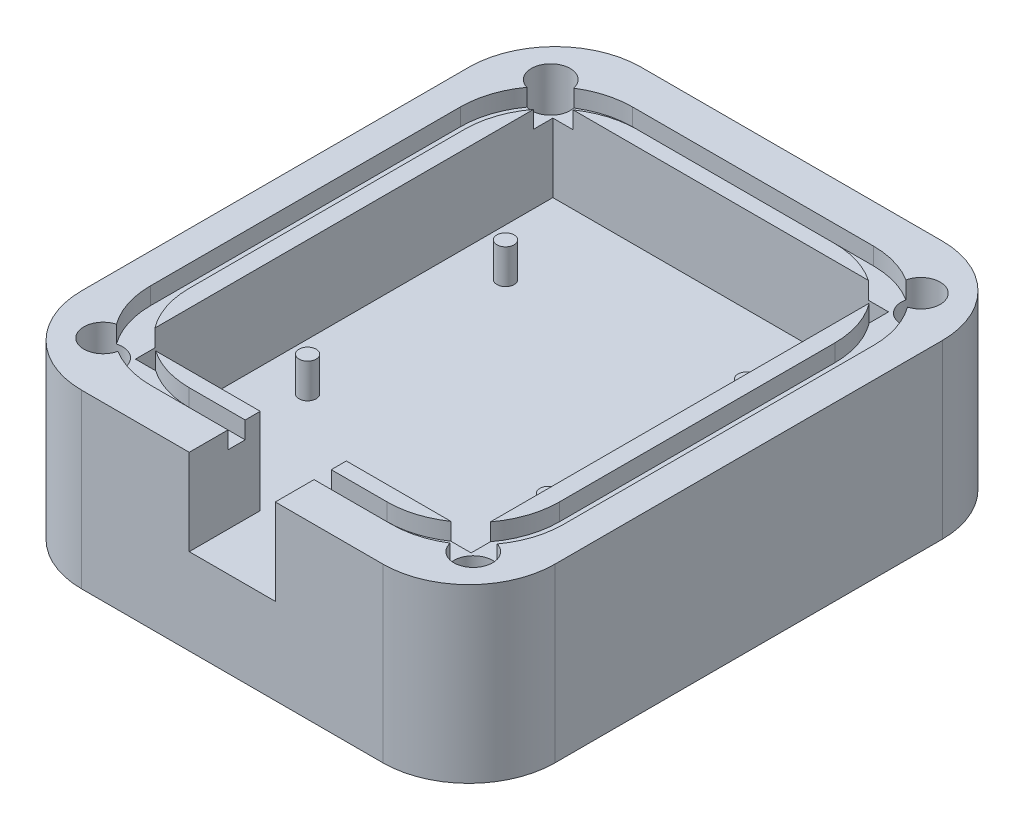
from build123d import *

# Parameters (mm, degrees)
BOSS_EXTRUDE1_DEPTH = 10
SKETCH2_W           = 39
SKETCH2_H           = 48.5
BOSS_EXTRUDE2_DEPTH = 10
SKETCH6_R           = 1
BOSS_EXTRUDE3_DEPTH = 4
SKETCH7_W           = 10
SKETCH7_H           = 8.25
CUT_EXTRUDE1_DEPTH  = 10
SKETCH8_R           = 2.25
CUT_EXTRUDE2_DEPTH  = 15
CUT_EXTRUDE3_DEPTH  = 2


with BuildPart() as part:
    # Sketch1 → Boss-Extrude1 (new body)
    with BuildSketch(Plane(origin=(0, 0, 0), x_dir=(1, 0, 0), z_dir=(0, 1, 0))):
        with BuildLine():
            Line((-17.5, 32.5), (17.5, 32.5))
            ThreePointArc((17.5, 32.5), (24.571067812, 29.571067812), (27.5, 22.5))
            Line((27.5, 22.5), (27.5, -22.5))
            ThreePointArc((27.5, -22.5), (24.571067812, -29.571067812), (17.5, -32.5))
            Line((17.5, -32.5), (-17.5, -32.5))
            ThreePointArc((-17.5, -32.5), (-24.571067812, -29.571067812), (-27.5, -22.5))
            Line((-27.5, -22.5), (-27.5, 22.5))
            ThreePointArc((-27.5, 22.5), (-24.571067812, 29.571067812), (-17.5, 32.5))
        make_face()
    extrude(amount=BOSS_EXTRUDE1_DEPTH)

    # Sketch2 → Boss-Extrude2 (add)
    with BuildSketch(Plane(origin=(0, 10, 0), x_dir=(1, 0, 0), z_dir=(0, 1, 0))):
        with BuildLine():
            Line((27.5, 22.5), (27.5, -22.5))
            ThreePointArc((27.5, -22.5), (24.571067812, -29.571067812), (17.5, -32.5))
            Line((17.5, -32.5), (-17.5, -32.5))
            ThreePointArc((-17.5, -32.5), (-24.571067812, -29.571067812), (-27.5, -22.5))
            Line((-27.5, -22.5), (-27.5, 22.5))
            ThreePointArc((-27.5, 22.5), (-24.571067812, 29.571067812), (-17.5, 32.5))
            Line((-17.5, 32.5), (17.5, 32.5))
            ThreePointArc((17.5, 32.5), (24.571067812, 29.571067812), (27.5, 22.5))
        make_face()
        Rectangle(SKETCH2_W, SKETCH2_H, mode=Mode.SUBTRACT)
    extrude(amount=BOSS_EXTRUDE2_DEPTH)

    # Sketch6 → Boss-Extrude3 (add)
    with BuildSketch(Plane(origin=(0, 10, 0), x_dir=(1, 0, 0), z_dir=(0, 1, 0))):
        with Locations(Location((-14, 13.25, 0), (0, 0, 90))):
            Circle(SKETCH6_R)
        with Locations(Location((14, 13.25, 0), (0, 0, 90))):
            Circle(SKETCH6_R)
        with Locations(Location((14, -9.75, 0), (0, 0, 90))):
            Circle(SKETCH6_R)
        with Locations(Location((-14, -9.75, 0), (0, 0, 90))):
            Circle(SKETCH6_R)
    extrude(amount=BOSS_EXTRUDE3_DEPTH)

    # Sketch7 → Cut-Extrude1 (cut)
    with BuildSketch(Plane(origin=(0, 20, 0), x_dir=(1, 0, 0), z_dir=(0, 1, 0))):
        with Locations((0, -28.375)):
            Rectangle(SKETCH7_W, SKETCH7_H)
    extrude(amount=-CUT_EXTRUDE1_DEPTH, mode=Mode.SUBTRACT)

    # Sketch8 → Cut-Extrude2 (cut)
    with BuildSketch(Plane(origin=(0, 20, 0), x_dir=(1, 0, 0), z_dir=(0, 1, 0))):
        with Locations(Location((-21.5, -26, 0), (0, 0, 270))):
            Circle(SKETCH8_R)
        with Locations(Location((21.5, -26, 0), (0, 0, 270))):
            Circle(SKETCH8_R)
        with Locations(Location((21.5, 26, 0), (0, 0, 270))):
            Circle(SKETCH8_R)
        with Locations(Location((-21.5, 26, 0), (0, 0, 270))):
            Circle(SKETCH8_R)
    extrude(amount=-CUT_EXTRUDE2_DEPTH, mode=Mode.SUBTRACT)

    # Sketch9 → Cut-Extrude3 (cut)
    with BuildSketch(Plane(origin=(0, 20, 0), x_dir=(1, 0, 0), z_dir=(0, 1, 0))):
        with BuildLine():
            Line((-14, 28), (14, 28))
            ThreePointArc((14, 28), (16.757724491, 27.612229483), (19.301576132, 26.478991126))
            ThreePointArc((19.301576132, 26.478991126), (19.96113246, 24.358541291), (22.119681664, 23.83701719))
            ThreePointArc((22.119681664, 23.83701719), (23.518319616, 21.066201507), (24, 18))
            Line((24, 18), (24, -18))
            ThreePointArc((24, -18), (23.518319616, -21.066201507), (22.119681664, -23.83701719))
            ThreePointArc((22.119681664, -23.83701719), (19.96113246, -24.358541291), (19.301576132, -26.478991126))
            ThreePointArc((19.301576132, -26.478991126), (16.757724491, -27.612229483), (14, -28))
            Line((14, -28), (-14, -28))
            ThreePointArc((-14, -28), (-16.757724491, -27.612229483), (-19.301576132, -26.478991126))
            ThreePointArc((-19.301576132, -26.478991126), (-19.96113246, -24.358541291), (-22.119681664, -23.83701719))
            ThreePointArc((-22.119681664, -23.83701719), (-23.518319616, -21.066201507), (-24, -18))
            Line((-24, -18), (-24, 18))
            ThreePointArc((-24, 18), (-23.518319616, 21.066201507), (-22.119681664, 23.83701719))
            ThreePointArc((-22.119681664, 23.83701719), (-19.96113246, 24.358541291), (-19.301576132, 26.478991126))
            ThreePointArc((-19.301576132, 26.478991126), (-16.757724491, 27.612229483), (-14, 28))
        make_face()
        with BuildLine():
            Line((-11.5, 26), (11.5, 26))
            ThreePointArc((11.5, 26), (18.571067812, 23.071067812), (21.5, 16))
            Line((21.5, 16), (21.5, -16))
            ThreePointArc((21.5, -16), (18.571067812, -23.071067812), (11.5, -26))
            Line((11.5, -26), (-11.5, -26))
            ThreePointArc((-11.5, -26), (-18.571067812, -23.071067812), (-21.5, -16))
            Line((-21.5, -16), (-21.5, 16))
            ThreePointArc((-21.5, 16), (-18.571067812, 23.071067812), (-11.5, 26))
        make_face(mode=Mode.SUBTRACT)
    extrude(amount=-CUT_EXTRUDE3_DEPTH, mode=Mode.SUBTRACT)


solid = part.part
